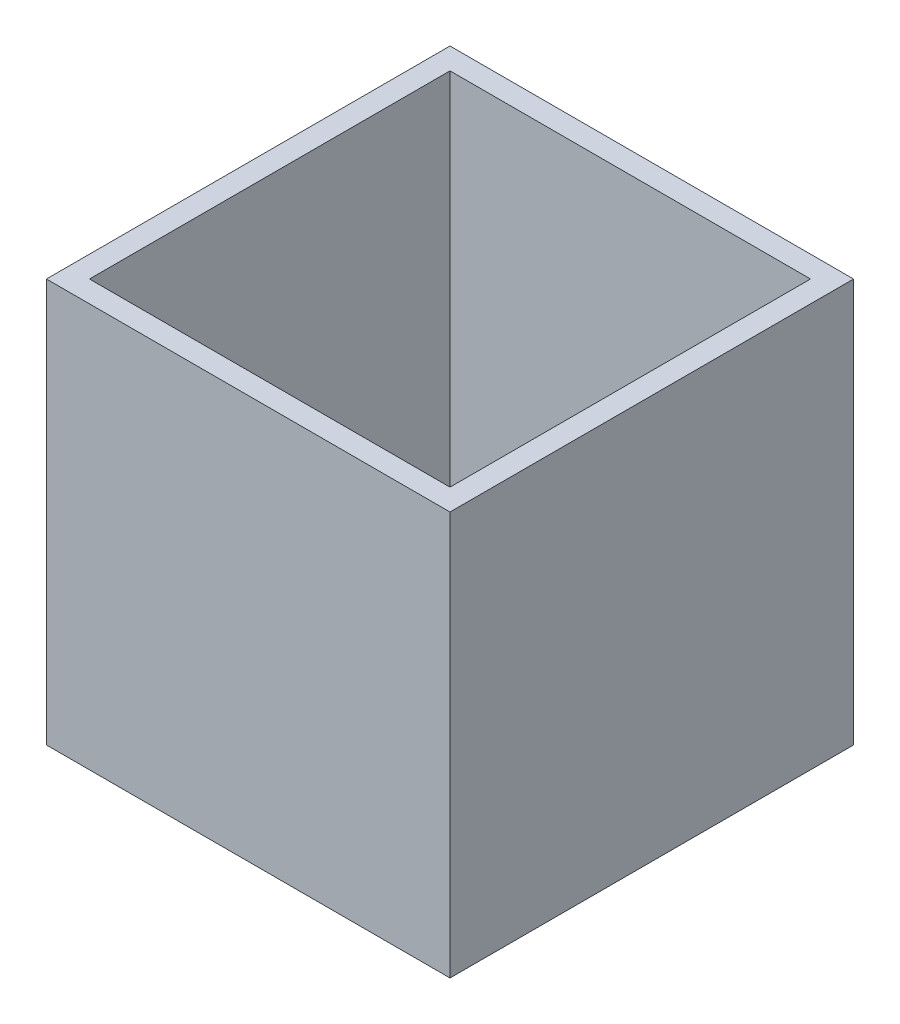
from build123d import *

# Parameters (mm, degrees)
SKETCH1_W           = 150
SKETCH1_H           = 150
BOSS_EXTRUDE1_DEPTH = 150
SKETCH9_W           = 134
SKETCH9_H           = 134
CUT_EXTRUDE1_DEPTH  = 142


with BuildPart() as part:
    # Sketch1 → Boss-Extrude1 (new body)
    with BuildSketch(Plane(origin=(0, 0, 0), x_dir=(1, 0, 0), z_dir=(0, 1, 0))):
        with Locations((75, 75)):
            Rectangle(SKETCH1_W, SKETCH1_H)
    extrude(amount=BOSS_EXTRUDE1_DEPTH)

    # Sketch9 → Cut-Extrude1 (cut)
    with BuildSketch(Plane(origin=(0, 150, 0), x_dir=(1, 0, 0), z_dir=(0, 1, 0))):
        with Locations((75, 75)):
            Rectangle(SKETCH9_W, SKETCH9_H)
    extrude(amount=-CUT_EXTRUDE1_DEPTH, mode=Mode.SUBTRACT)


solid = part.part
